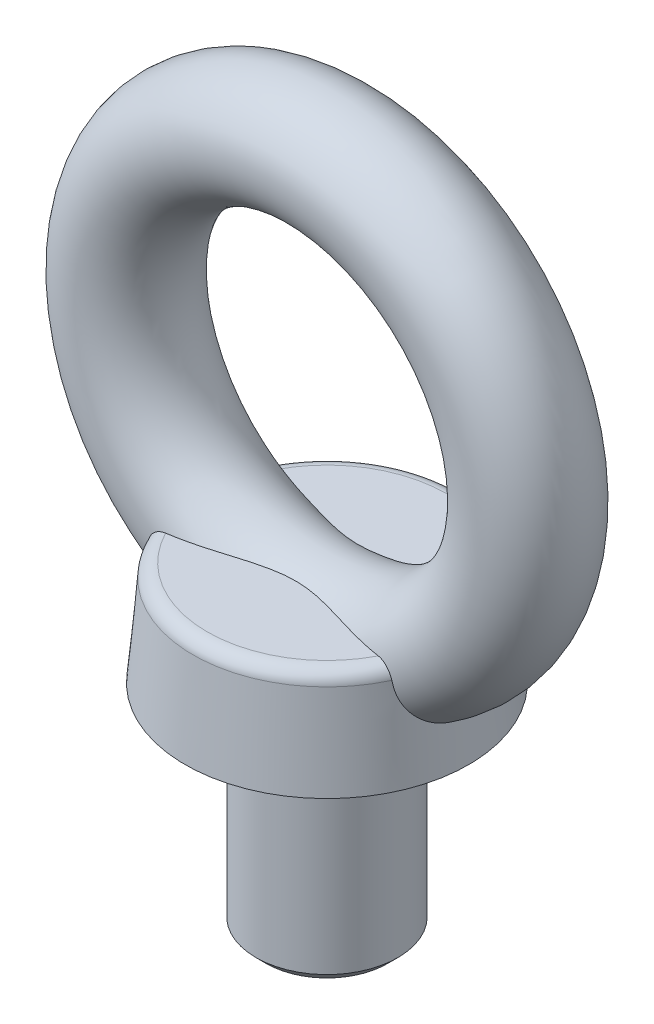
from build123d import *

# Parameters (mm, degrees)
SZKIC1_R = 12


with BuildPart() as part:
    # Szkic2 → Obrót1 (revolve)
    with BuildSketch(Plane.XY, mode=Mode.PRIVATE) as obr_t1_sk:
        with BuildLine():
            Line((0, 22), (25.32625588, 22))
            ThreePointArc((25.32625588, 22), (27.353026503, 21.21183201), (28.314839975, 19.261467228))
            Line((28.314839975, 19.261467228), (30, 0))
            Line((30, 0), (0, 0))
            Line((0, 0), (0, 22))
        make_face()
    revolve(obr_t1_sk.sketch.rotate(Axis((0, 0, 0), (0, 1, 0)), 180), axis=Axis((0, 0, 0), (0, 1, 0)))

    # Szkic1 → Obrót2 (revolve)
    with BuildSketch(Plane(origin=(0, 0, 0), x_dir=(0, 0, -1), z_dir=(1, 0, 0)), mode=Mode.PRIVATE) as obr_t2_sk:
        with Locations((0, 97)):
            Circle(SZKIC1_R)
    revolve(obr_t2_sk.sketch.rotate(Axis((0, 54.5, -12), (0, 0, 1)), 26.713183652), axis=Axis((0, 54.5, -12), (0, 0, 1)))

    # Szkic3 → Obrót3 (revolve)
    with BuildSketch(Plane.XY, mode=Mode.PRIVATE) as obr_t3_sk:
        Polygon((0, 0), (15, 0), (15, -42.853), (12.853, -45), (0, -45), align=None)
    revolve(obr_t3_sk.sketch.rotate(Axis((0, -45, 0), (0, 1, 0)), 270), axis=Axis((0, -45, 0), (0, 1, 0)))

    # Szkic4 → Wycięcie-obrót1 (revolve, cut)
    with BuildSketch(Plane.XY, mode=Mode.PRIVATE) as wyci_cie_obr_t1_sk:
        Polygon((13.5, 0), (13.5, -4.5), (15, -6), (15, 0), align=None)
    revolve(wyci_cie_obr_t1_sk.sketch.rotate(Axis((0, -45, 0), (0, 1, 0)), 270), axis=Axis((0, -45, 0), (0, 1, 0)), mode=Mode.SUBTRACT)


solid = part.part
